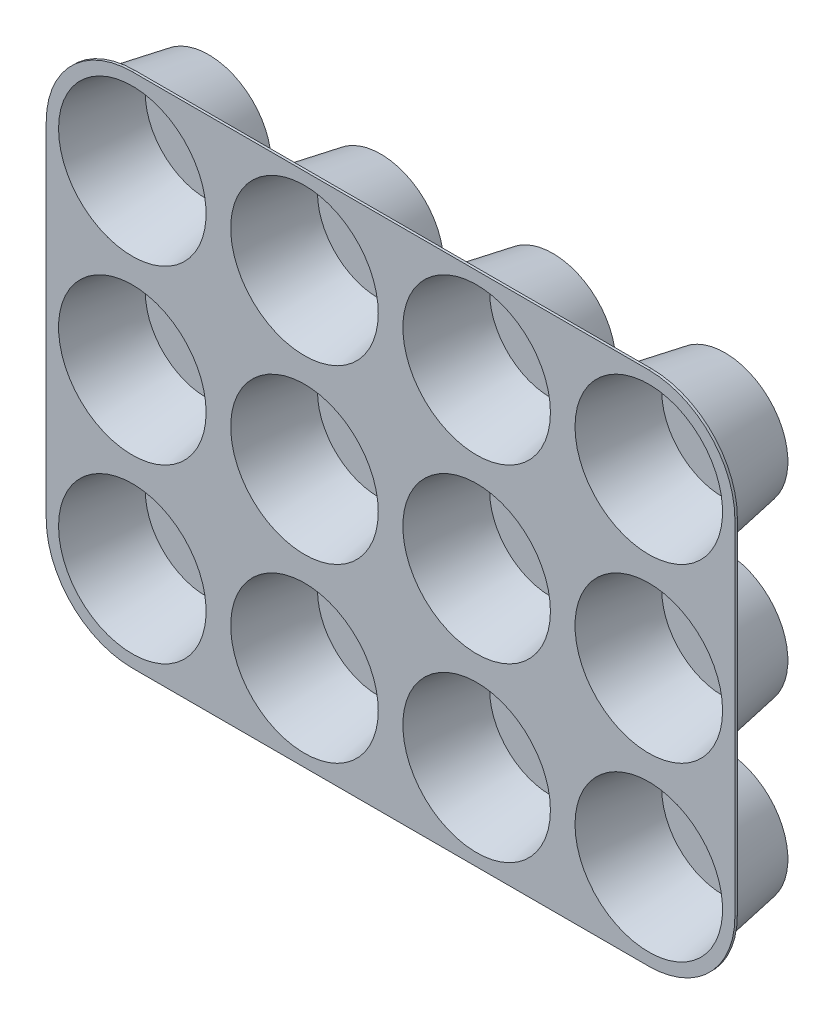
from build123d import *

# Parameters (mm, degrees)
LPATTERN1_COUNT     = 3
LPATTERN1_PITCH     = 88.9
LPATTERN1_2_COUNT   = 4
LPATTERN1_2_PITCH   = 88.9
SKETCH3_R           = 38.1
BOSS_EXTRUDE1_DEPTH = 1.27


with BuildPart() as part:
    # Sketch1 → Revolve1 (revolve)
    with BuildSketch(Plane.YZ, mode=Mode.PRIVATE) as revolve1_sk:
        Polygon((38.1, 0), (31.381942035, -38.1), (0, -38.1), (0, -39.37), (32.447598567, -39.37), (39.165656532, -1.27), (44.45, -1.27), (44.45, 0), align=None)
    revolve(revolve1_sk.sketch.rotate(Axis((0, 0, -38.1), (0, 0, 1)), 90), axis=Axis((0, 0, -38.1), (0, 0, 1)))


with BuildPart() as lpattern1_1:
    # LPattern1: pattern copy
    add(part.part.moved(Location(Vector(0, -1, 0) * (1 * LPATTERN1_PITCH))))


with BuildPart() as lpattern1_2:
    # LPattern1: pattern copy
    add(part.part.moved(Location(Vector(0, -1, 0) * (2 * LPATTERN1_PITCH))))


with BuildPart() as lpattern1_2_1:
    # LPattern1 2: pattern copy
    add(part.part.moved(Location(Vector(1, 0, 0) * (1 * LPATTERN1_2_PITCH))))


with BuildPart() as lpattern1_2_2:
    # LPattern1 2: pattern copy
    add(part.part.moved(Location(Vector(1, 0, 0) * (2 * LPATTERN1_2_PITCH))))


with BuildPart() as lpattern1_2_3:
    # LPattern1 2: pattern copy
    add(part.part.moved(Location(Vector(1, 0, 0) * (3 * LPATTERN1_2_PITCH))))


with BuildPart() as lpattern1_2_4:
    # LPattern1 2: pattern copy
    add(lpattern1_1.part.moved(Location(Vector(1, 0, 0) * (1 * LPATTERN1_2_PITCH))))


with BuildPart() as lpattern1_2_5:
    # LPattern1 2: pattern copy
    add(lpattern1_1.part.moved(Location(Vector(1, 0, 0) * (2 * LPATTERN1_2_PITCH))))


with BuildPart() as lpattern1_2_6:
    # LPattern1 2: pattern copy
    add(lpattern1_1.part.moved(Location(Vector(1, 0, 0) * (3 * LPATTERN1_2_PITCH))))


with BuildPart() as lpattern1_2_7:
    # LPattern1 2: pattern copy
    add(lpattern1_2.part.moved(Location(Vector(1, 0, 0) * (1 * LPATTERN1_2_PITCH))))


with BuildPart() as lpattern1_2_8:
    # LPattern1 2: pattern copy
    add(lpattern1_2.part.moved(Location(Vector(1, 0, 0) * (2 * LPATTERN1_2_PITCH))))


with BuildPart() as lpattern1_2_9:
    # LPattern1 2: pattern copy
    add(lpattern1_2.part.moved(Location(Vector(1, 0, 0) * (3 * LPATTERN1_2_PITCH))))


with BuildPart() as part_1:
    add(part.part)

    add(lpattern1_1.part)  # Boss-Extrude1 merges LPattern1_1

    add(lpattern1_2.part)  # Boss-Extrude1 merges LPattern1_2

    add(lpattern1_2_1.part)  # Boss-Extrude1 merges LPattern1 2_1

    add(lpattern1_2_2.part)  # Boss-Extrude1 merges LPattern1 2_2

    add(lpattern1_2_3.part)  # Boss-Extrude1 merges LPattern1 2_3

    add(lpattern1_2_4.part)  # Boss-Extrude1 merges LPattern1 2_4

    add(lpattern1_2_5.part)  # Boss-Extrude1 merges LPattern1 2_5

    add(lpattern1_2_6.part)  # Boss-Extrude1 merges LPattern1 2_6

    add(lpattern1_2_7.part)  # Boss-Extrude1 merges LPattern1 2_7

    add(lpattern1_2_8.part)  # Boss-Extrude1 merges LPattern1 2_8

    add(lpattern1_2_9.part)  # Boss-Extrude1 merges LPattern1 2_9
    # Sketch3 → Boss-Extrude1 (add)
    with BuildSketch(Plane.XY):
        with BuildLine():
            ThreePointArc((44.45, -177.8), (31.430896424, -209.230896424), (0, -222.25))
            Line((0, -222.25), (266.7, -222.25))
            ThreePointArc((266.7, -222.25), (235.269103576, -146.369103576), (311.15, -177.8))
            Line((311.15, -177.8), (311.15, 0))
            ThreePointArc((311.15, 0), (235.269103576, -31.430896424), (266.7, 44.45))
            Line((266.7, 44.45), (0, 44.45))
            ThreePointArc((0, 44.45), (31.430896424, 31.430896424), (44.45, 0))
            ThreePointArc((44.45, 0), (0, -44.45), (-44.45, 0))
            Line((-44.45, 0), (-44.45, -177.8))
            ThreePointArc((-44.45, -177.8), (0, -133.35), (44.45, -177.8))
        make_face()
        with Locations((88.9, -177.8)):
            Circle(SKETCH3_R, mode=Mode.SUBTRACT)
        with Locations((177.8, -177.8)):
            Circle(SKETCH3_R, mode=Mode.SUBTRACT)
        with Locations((0, -88.9)):
            Circle(SKETCH3_R, mode=Mode.SUBTRACT)
        with Locations((88.9, -88.9)):
            Circle(SKETCH3_R, mode=Mode.SUBTRACT)
        with Locations((88.9, 0)):
            Circle(SKETCH3_R, mode=Mode.SUBTRACT)
        with Locations((177.8, -88.9)):
            Circle(SKETCH3_R, mode=Mode.SUBTRACT)
        with Locations((266.7, -88.9)):
            Circle(SKETCH3_R, mode=Mode.SUBTRACT)
        with Locations((177.8, 0)):
            Circle(SKETCH3_R, mode=Mode.SUBTRACT)
    extrude(amount=-BOSS_EXTRUDE1_DEPTH)


solid = part_1.part
